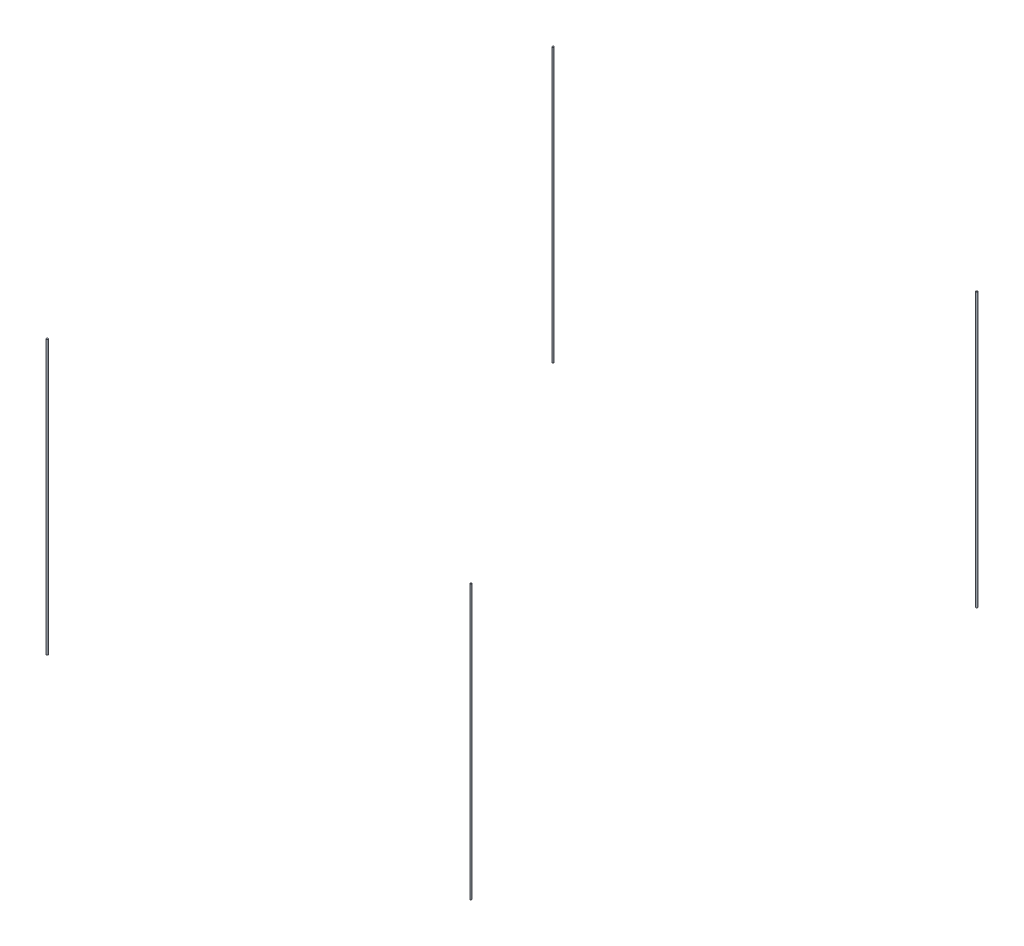
from build123d import *

# Parameters (mm, degrees)
SKETCH1_R             = 6
BOSS_EXTRUDE1_DEPTH   = 2000
BOSS_EXTRUDE1_2_DEPTH = 2000
BOSS_EXTRUDE1_3_DEPTH = 2000
BOSS_EXTRUDE1_4_DEPTH = 2000


with BuildPart() as part:
    # Sketch1 → Boss-Extrude1 (new body)
    with BuildSketch(Plane(origin=(0, 0, 0), x_dir=(1, 0, 0), z_dir=(0, 1, 0))):
        with Locations(Location((-3100, 3700, 0), (0, 0, 270))):
            Circle(SKETCH1_R)
    extrude(amount=BOSS_EXTRUDE1_DEPTH)


with BuildPart() as body_2:
    # Sketch1 → Boss-Extrude1 2 (new body)
    with BuildSketch(Plane(origin=(0, 0, 0), x_dir=(1, 0, 0), z_dir=(0, 1, 0))):
        with Locations(Location((0, 3700, 0), (0, 0, 270))):
            Circle(SKETCH1_R)
    extrude(amount=BOSS_EXTRUDE1_2_DEPTH)


with BuildPart() as body_3:
    # Sketch1 → Boss-Extrude1 3 (new body)
    with BuildSketch(Plane(origin=(0, 0, 0), x_dir=(1, 0, 0), z_dir=(0, 1, 0))):
        with Locations(Location((0, 0, 0), (0, 0, 270))):
            Circle(SKETCH1_R)
    extrude(amount=BOSS_EXTRUDE1_3_DEPTH)


with BuildPart() as body_4:
    # Sketch1 → Boss-Extrude1 4 (new body)
    with BuildSketch(Plane(origin=(0, 0, 0), x_dir=(1, 0, 0), z_dir=(0, 1, 0))):
        with Locations(Location((-3100, 0, 0), (0, 0, 270))):
            Circle(SKETCH1_R)
    extrude(amount=BOSS_EXTRUDE1_4_DEPTH)


solid = Compound([part.part, body_2.part, body_3.part, body_4.part])
